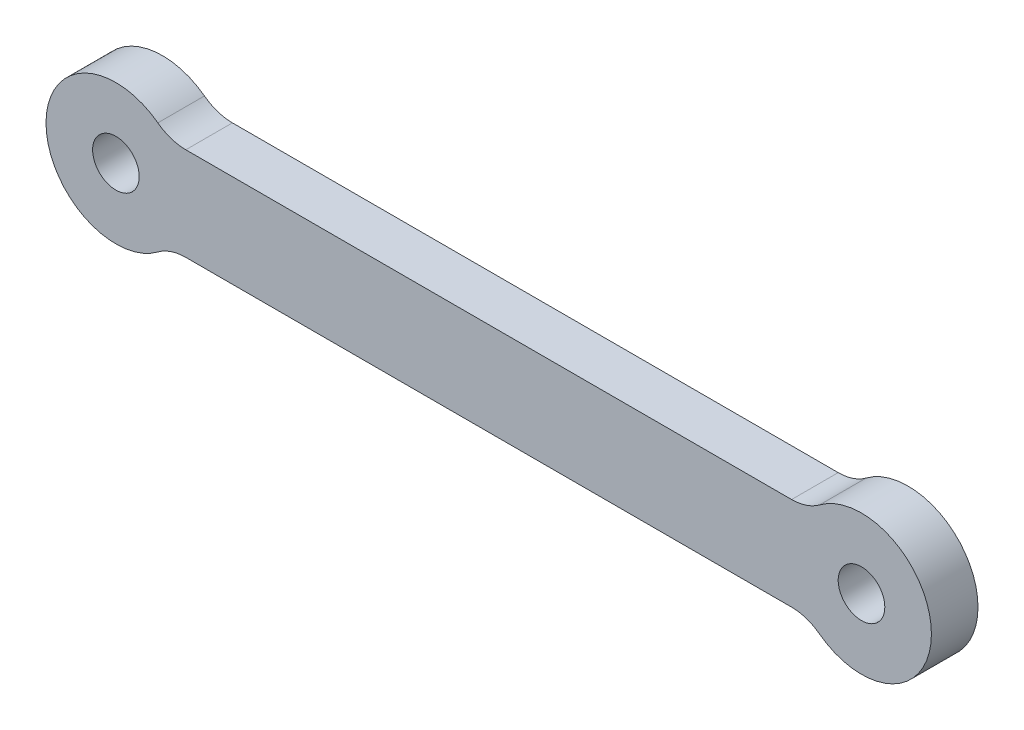
from build123d import *

# Parameters (mm, degrees)
SKETCH1_R           = 3.175
BOSS_EXTRUDE1_DEPTH = 3.175


with BuildPart() as part:
    # Sketch1 → Boss-Extrude1 (new, symmetric)
    with BuildSketch(Plane.XY):
        with BuildLine():
            Line((-92.075, 6.35), (-9.525, 6.35))
            ThreePointArc((-9.525, 6.35), (-7.516953686, 6.675861057), (-5.715, 7.62))
            ThreePointArc((-5.715, 7.62), (9.525, 0), (-5.715, -7.62))
            ThreePointArc((-5.715, -7.62), (-7.516953686, -6.675861057), (-9.525, -6.35))
            Line((-9.525, -6.35), (-92.075, -6.35))
            ThreePointArc((-92.075, -6.35), (-94.083046314, -6.675861057), (-95.885, -7.62))
            ThreePointArc((-95.885, -7.62), (-111.125, 0), (-95.885, 7.62))
            ThreePointArc((-95.885, 7.62), (-94.083046314, 6.675861057), (-92.075, 6.35))
        make_face()
        with Locations((-101.6, 0)):
            Circle(SKETCH1_R, mode=Mode.SUBTRACT)
        Circle(SKETCH1_R, mode=Mode.SUBTRACT)
    extrude(amount=BOSS_EXTRUDE1_DEPTH, both=True)


solid = part.part
